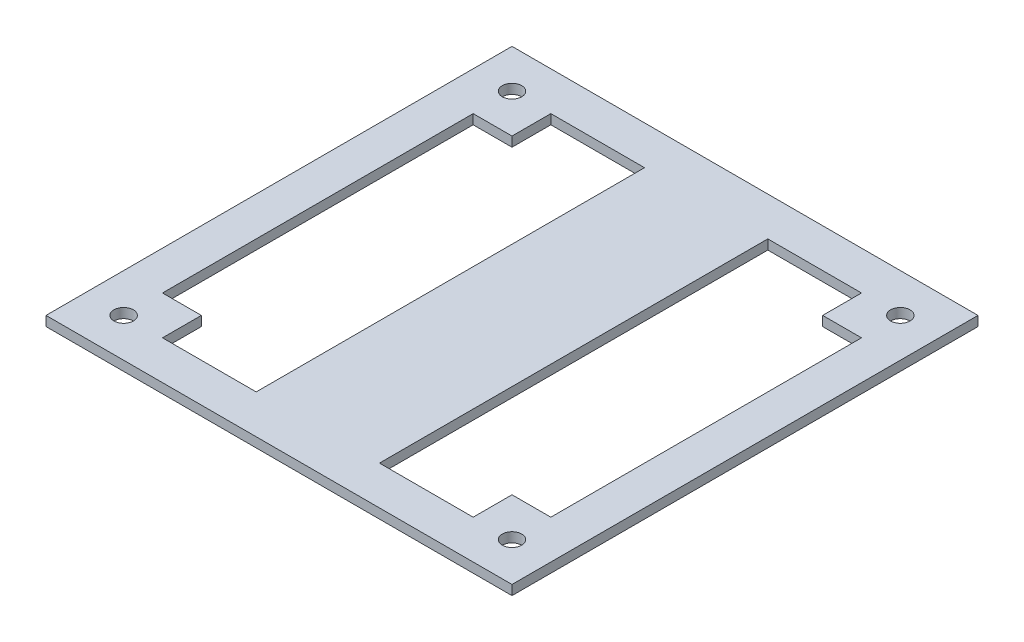
from build123d import *

# Parameters (mm, degrees)
SKETCH2_W           = 240
SKETCH2_H           = 240
BOSS_EXTRUDE1_DEPTH = 5
SKETCH3_W           = 63.5
SKETCH3_H           = 200
BOSS_EXTRUDE2_DEPTH = 5
SKETCH10_R          = 5
CUT_EXTRUDE1_DEPTH  = 10


with BuildPart() as part:
    # Sketch2 → Boss-Extrude1 (new body)
    with BuildSketch(Plane(origin=(0, 0, 0), x_dir=(1, 0, 0), z_dir=(0, 1, 0))):
        with Locations((0, 120)):
            Rectangle(SKETCH2_W, SKETCH2_H)
        Polygon((-100, 200), (-100, 40), (-80, 40), (-80, 20), (80, 20), (80, 40), (100, 40), (100, 200), (80, 200), (80, 220), (-80, 220), (-80, 200), align=None, mode=Mode.SUBTRACT)
    extrude(amount=-BOSS_EXTRUDE1_DEPTH)

    # Sketch3 → Boss-Extrude2 (add)
    with BuildSketch(Plane(origin=(0, 0, 0), x_dir=(1, 0, 0), z_dir=(0, 1, 0))):
        with Locations((0, 120)):
            Rectangle(SKETCH3_W, SKETCH3_H)
    extrude(amount=-BOSS_EXTRUDE2_DEPTH)

    # Sketch10 → Cut-Extrude1 (cut)
    with BuildSketch(Plane(origin=(0, 0, 0), x_dir=(1, 0, 0), z_dir=(0, 1, 0))):
        with Locations(Location((-100, 20, 0), (0, 0, 270))):
            Circle(SKETCH10_R)
        with Locations(Location((100, 20, 0), (0, 0, 270))):
            Circle(SKETCH10_R)
        with Locations(Location((-100, 220, 0), (0, 0, 270))):
            Circle(SKETCH10_R)
        with Locations(Location((100, 220, 0), (0, 0, 270))):
            Circle(SKETCH10_R)
    extrude(amount=-CUT_EXTRUDE1_DEPTH, mode=Mode.SUBTRACT)


solid = part.part
